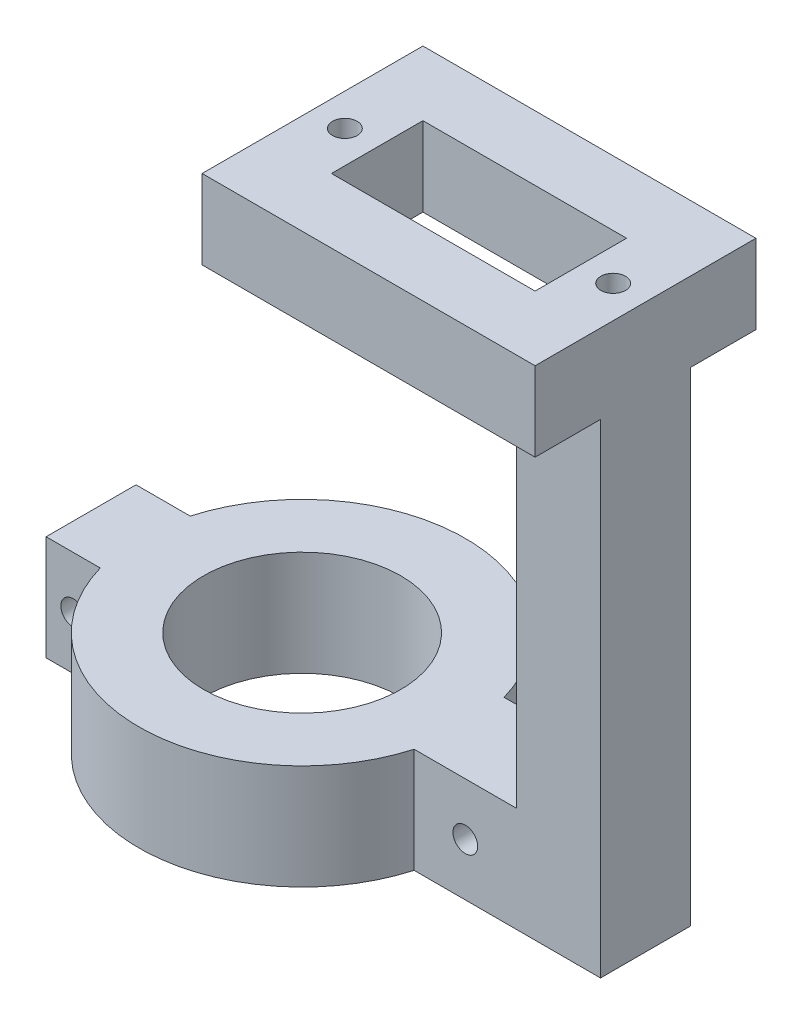
from build123d import *

# Parameters (mm, degrees)
SKETCH_1_W          = 51.5
SKETCH_1_H          = 34.15
SKETCH_1_W_2        = 31.5
SKETCH_1_H_2        = 14.15
EXTRUDE_1_DEPTH     = 12.25
SKETCH_2_R          = 1.91
CUT_EXTRUDE_1_DEPTH = 34.236736076
SKETCH_4_W          = 13
SKETCH_4_H          = 13.91
EXTRUDE_1_2_DEPTH   = 74.82
SKETCH_5_W          = 13.91
SKETCH_5_H          = 16.23
EXTRUDE_2_DEPTH     = 16
SKETCH_7_R          = 25.25
SKETCH_7_R_2        = 15.25
EXTRUDE_2_2_DEPTH   = 16.23
SKETCH_15_R         = 1.91
CUT_EXTRUDE_6_DEPTH = 97.964478439
SKETCH_16_W         = 13.91
SKETCH_16_H         = 16.23
EXTRUDE_4_DEPTH     = 10
SKETCH_17_R         = 1.91
CUT_EXTRUDE_7_DEPTH = 102.16913771


with BuildPart() as part:
    # 草圖1 → Extrude 1 (new body)
    with BuildSketch(Plane(origin=(0, 0, 0), x_dir=(1, 0, 0), z_dir=(0, 1, 0))):
        Rectangle(SKETCH_1_W, SKETCH_1_H)
        Rectangle(SKETCH_1_W_2, SKETCH_1_H_2, mode=Mode.SUBTRACT)
    extrude(amount=EXTRUDE_1_DEPTH)

    # 草圖2 → 除料-伸長1 (cut, through all)
    with BuildSketch(Plane(origin=(0, 12.25, 0), x_dir=(1, 0, 0), z_dir=(0, 1, 0))):
        with Locations((-20.75, 0)):
            Circle(SKETCH_2_R)
        with Locations((20.75, 0)):
            Circle(SKETCH_2_R)
    extrude(amount=-CUT_EXTRUDE_1_DEPTH, mode=Mode.SUBTRACT)

    # 草圖4 → Extrude 1 2 (add)
    with BuildSketch(Plane.XZ):
        with Locations((19.25, 0)):
            Rectangle(SKETCH_4_W, SKETCH_4_H)
    extrude(amount=EXTRUDE_1_2_DEPTH)

    # 草圖5 → Extrude 2 (add)
    with BuildSketch(Plane.ZY.offset(-12.75)):
        with Locations((0, -66.705)):
            Rectangle(SKETCH_5_W, SKETCH_5_H)
    extrude(amount=EXTRUDE_2_DEPTH)

    # 草圖7 → Extrude 2 2 (add)
    with BuildSketch(Plane(origin=(3.626674765, -74.82, 0), x_dir=(1, 0, 0), z_dir=(0, -1, 0))):
        with Locations((-30.978154344, 0)):
            Circle(SKETCH_7_R)
        with Locations((-30.978154344, 0)):
            Circle(SKETCH_7_R_2, mode=Mode.SUBTRACT)
    extrude(amount=-EXTRUDE_2_2_DEPTH)

    # 草圖15 → 除料-伸長6 (cut, through all)
    with BuildSketch(Plane(origin=(0, 0, -6.955), x_dir=(-1, 0, 0), z_dir=(0, 0, -1))):
        with Locations((-4.835883248, -66.705)):
            Circle(SKETCH_15_R)
    extrude(amount=-CUT_EXTRUDE_6_DEPTH, mode=Mode.SUBTRACT)

    # 草圖16 → 填料-伸長4 (add)
    with BuildSketch(Plane(origin=(-60, 0, 0), x_dir=(0, 0, -1), z_dir=(1, 0, 0))):
        with Locations((0, -66.705)):
            Rectangle(SKETCH_16_W, SKETCH_16_H)
    extrude(amount=EXTRUDE_4_DEPTH)

    # 草圖17 → 除料-伸長7 (cut, through all)
    with BuildSketch(Plane(origin=(0, 0, -6.955), x_dir=(-1, 0, 0), z_dir=(0, 0, -1))):
        with Locations((55.812362827, -66.705)):
            Circle(SKETCH_17_R)
    extrude(amount=-CUT_EXTRUDE_7_DEPTH, mode=Mode.SUBTRACT)


solid = part.part
